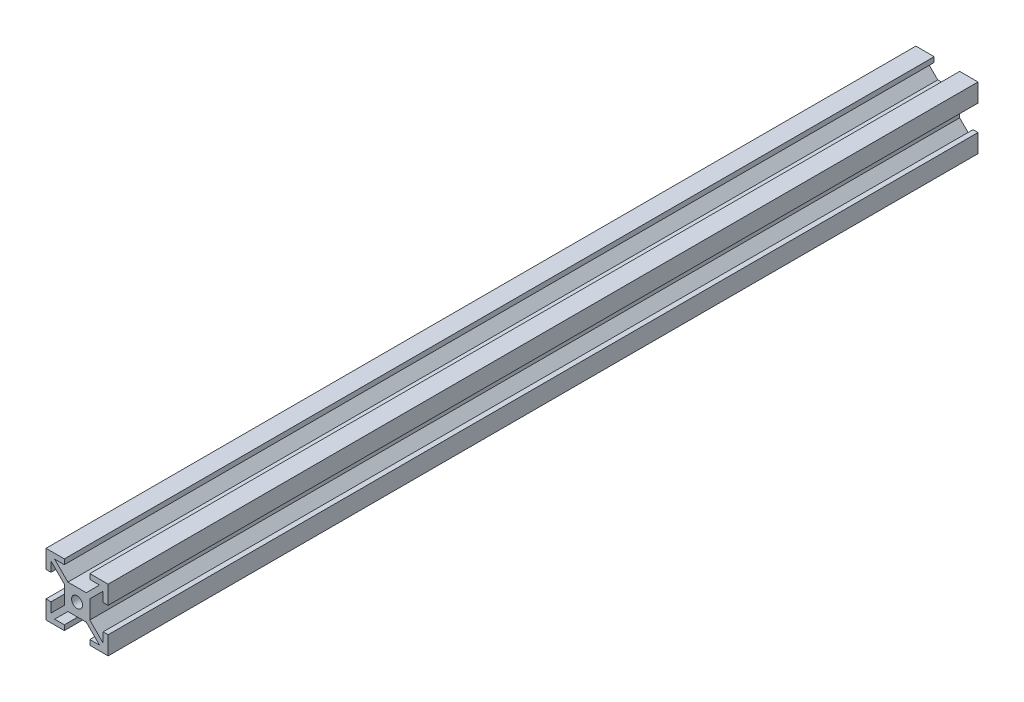
from build123d import *

# Parameters (mm, degrees)
SKETCH1_R           = 1.77
BOSS_EXTRUDE1_DEPTH = 280


with BuildPart() as part:
    # Sketch1 → Boss-Extrude1 (new body)
    with BuildSketch(Plane.XY):
        Polygon((-8.38, 4.1), (-10, 4.1), (-10, 10), (-4.1, 10), (-4.1, 8.38), (-7.234487014, 8.38), (-2.954487014, 4.1), (2.954487014, 4.1), (7.234487014, 8.38), (4.1, 8.38), (4.1, 10), (10, 10), (10, 4.1), (8.38, 4.1), (8.38, 7.234487014), (4.1, 2.954487014), (4.1, -2.954487014), (8.38, -7.234487014), (8.38, -4.1), (10, -4.1), (10, -10), (4.1, -10), (4.1, -8.38), (7.234487014, -8.38), (2.954487014, -4.1), (-2.954487014, -4.1), (-7.234487014, -8.38), (-4.1, -8.38), (-4.1, -10), (-10, -10), (-10, -4.1), (-8.38, -4.1), (-8.38, -7.234487014), (-4.1, -2.954487014), (-4.1, 2.954487014), (-8.38, 7.234487014), align=None)
        Circle(SKETCH1_R, mode=Mode.SUBTRACT)
    extrude(amount=BOSS_EXTRUDE1_DEPTH)


solid = part.part
